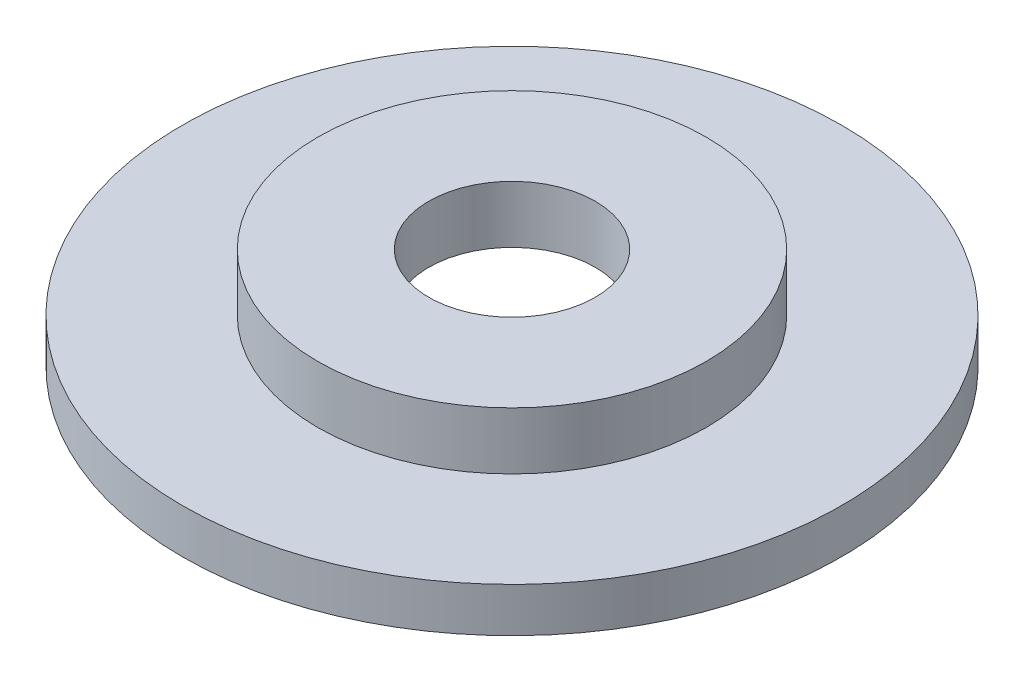
from build123d import *


with BuildPart() as part:
    # Sketch1 → Revolve1 (revolve)
    with BuildSketch(Plane.XY, mode=Mode.PRIVATE) as revolve1_sk:
        Polygon((-4.435, 0), (-4.435, 1.28), (-2.4, 1.28), (-2.4, 2.93), (-5.6, 2.93), (-5.6, 1.28), (-9.5, 1.28), (-9.5, 0), align=None)
    revolve(revolve1_sk.sketch.rotate(Axis((0, 0, 0), (0, 1, 0)), 270), axis=Axis((0, 0, 0), (0, 1, 0)))


solid = part.part
